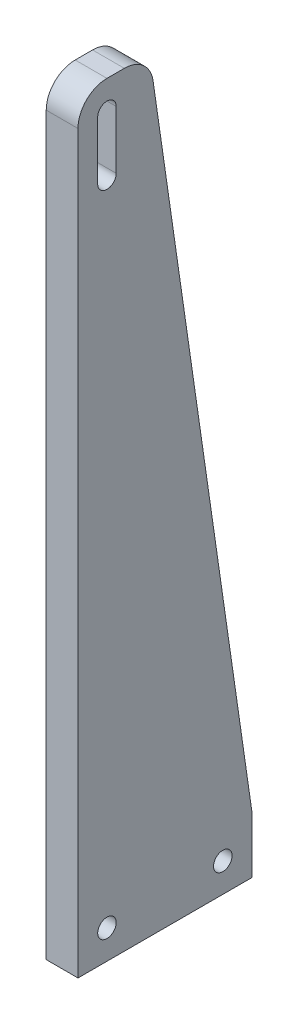
from build123d import *

# Parameters (mm, degrees)
SKETCH1_R           = 1.6
BOSS_EXTRUDE1_DEPTH = 5.4864


with BuildPart() as part:
    # Sketch1 → Boss-Extrude1 (new body)
    with BuildSketch(Plane(origin=(0, 0, 0), x_dir=(0, 0, -1), z_dir=(1, 0, 0))):
        with BuildLine():
            Line((0, 0), (30, 0))
            Line((30, 0), (30, 10))
            Line((30, 10), (12.948355245, 127.716784747))
            ThreePointArc((12.948355245, 127.716784747), (11.272313881, 130.780471117), (8, 132))
            Line((8, 132), (5, 132))
            ThreePointArc((5, 132), (1.464466094, 130.535533906), (0, 127))
            Line((0, 127), (0, 0))
        make_face()
        with Locations((5, 5)):
            Circle(SKETCH1_R, mode=Mode.SUBTRACT)
        with Locations((25, 5)):
            Circle(SKETCH1_R, mode=Mode.SUBTRACT)
        with BuildLine():
            Line((3.4, 117), (3.4, 127))
            ThreePointArc((3.4, 127), (5, 128.6), (6.6, 127))
            Line((6.6, 127), (6.6, 117))
            ThreePointArc((6.6, 117), (5, 115.4), (3.4, 117))
        make_face(mode=Mode.SUBTRACT)
    extrude(amount=BOSS_EXTRUDE1_DEPTH)


solid = part.part
